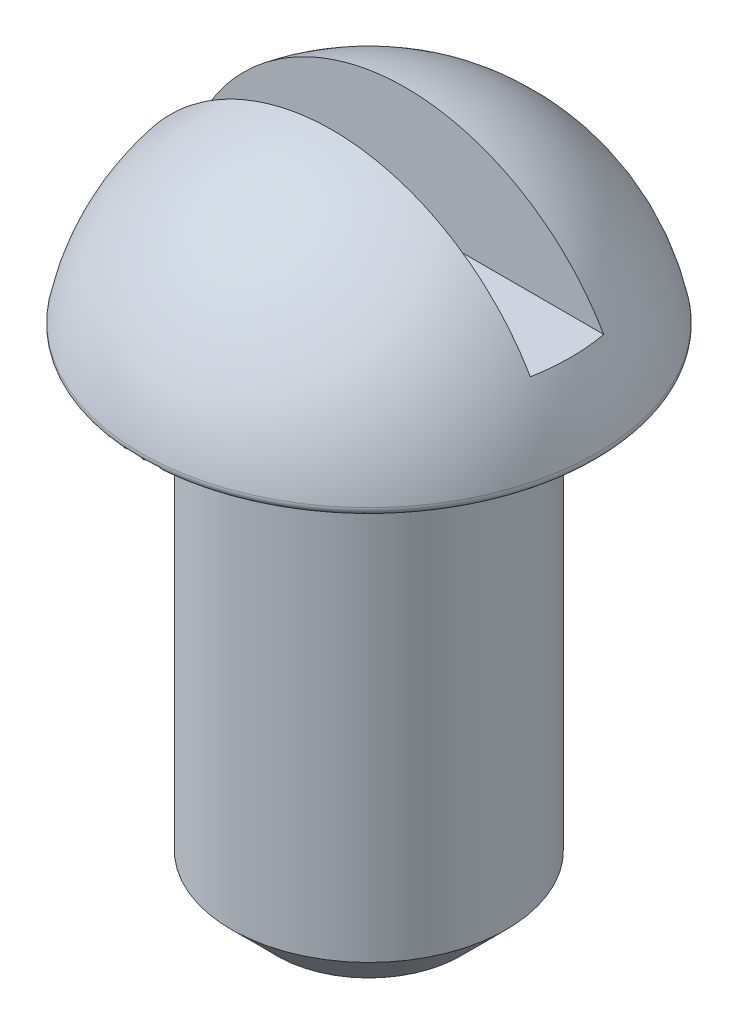
from build123d import *

# Parameters (mm, degrees)
SKETCH_13_W         = 10
SKETCH_13_H         = 1.6
CUT_EXTRUDE_9_DEPTH = 2.5
FILLET_1_R          = 0.15
CHAMFER_1_SIZE      = 1


with BuildPart() as part:
    # Эскиз1 → Повернуть1 (revolve)
    with BuildSketch(Plane.XY):
        with BuildLine():
            Line((3, 90.04931314), (5, 90.04931314))
            ThreePointArc((5, 90.04931314), (3.574521541, 92.823834681), (0.8, 94.24931314))
            Line((0.8, 94.24931314), (0, 94.24931314))
            Line((0, 94.24931314), (0, 79.24931314))
            Line((0, 79.24931314), (3, 79.24931314))
            Line((3, 79.24931314), (3, 90.04931314))
        make_face()
    revolve(axis=Axis((0, 125.763182898, 0), (0, -1, 0)))

    # Эскиз13 → Вырез-Вытянуть9 (cut)
    with BuildSketch(Plane(origin=(0, 94.24931314, 0), x_dir=(-1, 0, 0), z_dir=(0, 1, 0))):
        Rectangle(SKETCH_13_W, SKETCH_13_H)
    extrude(amount=-CUT_EXTRUDE_9_DEPTH, mode=Mode.SUBTRACT)

    # Скругление1
    fillet_1_edges = [part.edges().sort_by_distance(p)[0] for p in [
        (-5, 90.04931314, 0),
    ]]
    fillet(fillet_1_edges, radius=FILLET_1_R)

    # Фаска1
    chamfer_1_edges = [part.edges().sort_by_distance(p)[0] for p in [
        (-3, 79.24931314, 0),
    ]]
    chamfer(chamfer_1_edges, length=CHAMFER_1_SIZE)


solid = part.part
